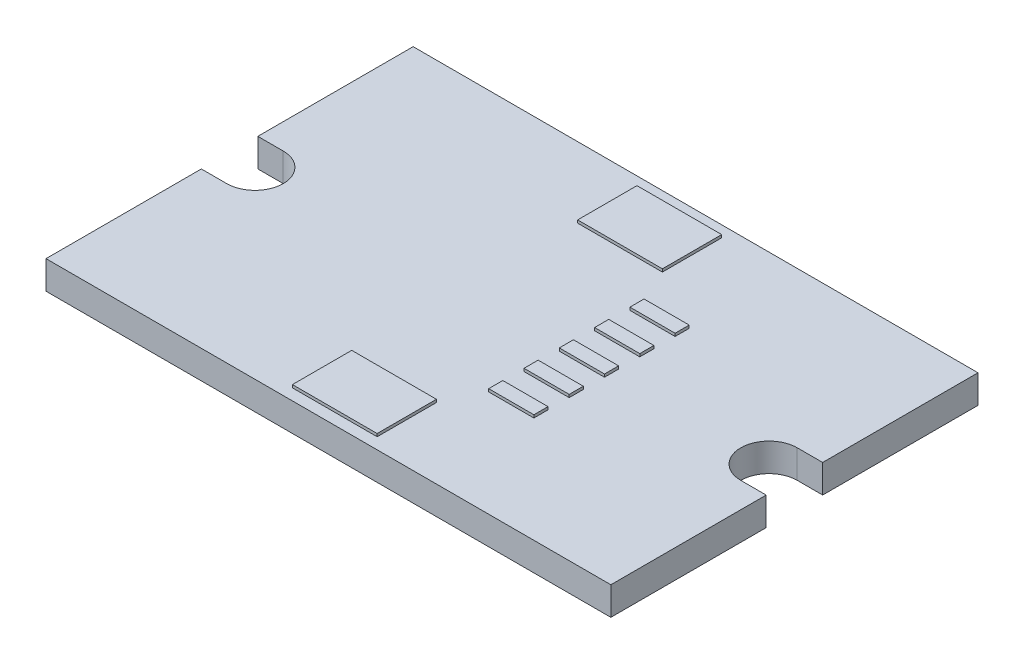
from build123d import *

# Parameters (mm, degrees)
BOSS_EXTRUDE1_DEPTH = 1
SKETCH2_W           = 3
SKETCH2_H           = 2.1
SKETCH2_W_2         = 1.6
SKETCH2_H_2         = 0.5
BOSS_EXTRUDE2_DEPTH = 0.1


with BuildPart() as part:
    # Sketch1 → Boss-Extrude1 (new body)
    with BuildSketch(Plane(origin=(0, 0, 0), x_dir=(1, 0, 0), z_dir=(0, 1, 0))):
        with BuildLine():
            Line((-10, 6.5), (10, 6.5))
            Line((10, 6.5), (10, 1))
            Line((10, 1), (9.1, 1))
            ThreePointArc((9.1, 1), (8.1, 0), (9.1, -1))
            Line((9.1, -1), (10, -1))
            Line((10, -1), (10, -6.5))
            Line((10, -6.5), (-10, -6.5))
            Line((-10, -6.5), (-10, -1))
            Line((-10, -1), (-9.1, -1))
            ThreePointArc((-9.1, -1), (-8.1, 0), (-9.1, 1))
            Line((-9.1, 1), (-10, 1))
            Line((-10, 1), (-10, 6.5))
        make_face()
    extrude(amount=BOSS_EXTRUDE1_DEPTH)

    # Sketch2 → Boss-Extrude2 (add)
    with BuildSketch(Plane(origin=(0, 1, 0), x_dir=(1, 0, 0), z_dir=(0, 1, 0))):
        with Locations((-0.175, -5.05)):
            Rectangle(SKETCH2_W, SKETCH2_H)
        with Locations((2.725, -2.5)):
            Rectangle(SKETCH2_W_2, SKETCH2_H_2)
        with Locations((2.725, -1.25)):
            Rectangle(SKETCH2_W_2, SKETCH2_H_2)
        with Locations((2.725, 0)):
            Rectangle(SKETCH2_W_2, SKETCH2_H_2)
        with Locations((2.725, 1.25)):
            Rectangle(SKETCH2_W_2, SKETCH2_H_2)
        with Locations((2.725, 2.5)):
            Rectangle(SKETCH2_W_2, SKETCH2_H_2)
        with Locations((-0.175, 5.05)):
            Rectangle(SKETCH2_W, SKETCH2_H)
    extrude(amount=BOSS_EXTRUDE2_DEPTH)


solid = part.part
